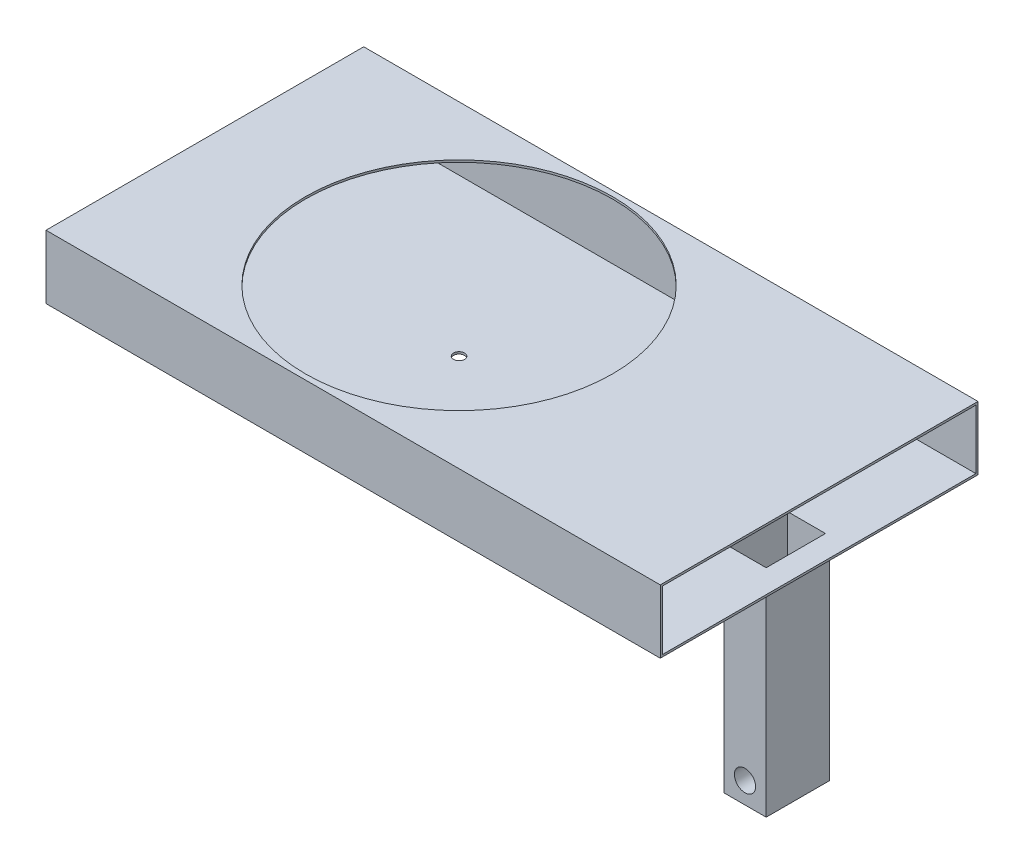
from build123d import *

# Parameters (mm, degrees)
SKETCH1_W           = 736.6
SKETCH1_H           = 381
BOSS_EXTRUDE1_DEPTH = 76.2
SKETCH2_W           = 50.8
SKETCH2_H           = 76.2
BOSS_EXTRUDE2_DEPTH = 254
SKETCH3_R           = 12.7
CUT_EXTRUDE1_DEPTH  = 503.413027299
SHELL1_T            = -2.54
SKETCH4_R           = 184.15
CUT_EXTRUDE2_DEPTH  = 2.54
SKETCH5_R           = 6.621401099
CUT_EXTRUDE3_DEPTH  = 1219.2


with BuildPart() as part:
    # Sketch1 → Boss-Extrude1 (new body)
    with BuildSketch(Plane(origin=(0, 0, 0), x_dir=(1, 0, 0), z_dir=(0, 1, 0))):
        Rectangle(SKETCH1_W, SKETCH1_H)
    extrude(amount=BOSS_EXTRUDE1_DEPTH)

    # Sketch2 → Boss-Extrude2 (add)
    with BuildSketch(Plane(origin=(0, 0, 0), x_dir=(-1, 0, 0), z_dir=(0, -1, 0))):
        with Locations((-317.5, 0)):
            Rectangle(SKETCH2_W, SKETCH2_H)
    extrude(amount=BOSS_EXTRUDE2_DEPTH)

    # Sketch3 → Cut-Extrude1 (cut, through all)
    with BuildSketch(Plane.XY.offset(38.1)):
        with Locations((317.5, -228.6)):
            Circle(SKETCH3_R)
    extrude(amount=-CUT_EXTRUDE1_DEPTH, mode=Mode.SUBTRACT)

    # Shell1
    shell1_openings = [part.faces().sort_by_distance(p)[0] for p in [
        (-368.3, 38.1, 0),
        (368.3, 38.1, 0),
    ]]
    offset(amount=SHELL1_T, openings=shell1_openings, kind=Kind.INTERSECTION)

    # Sketch4 → Cut-Extrude2 (cut)
    with BuildSketch(Plane(origin=(0, 76.2, 0), x_dir=(1, 0, 0), z_dir=(0, 1, 0))):
        with Locations(Location((-63.5, 0, 0), (0, 0, 270))):
            Circle(SKETCH4_R)
    extrude(amount=-CUT_EXTRUDE2_DEPTH, mode=Mode.SUBTRACT)

    # Sketch5 → Cut-Extrude3 (cut)
    with BuildSketch(Plane(origin=(0, 76.2, 0), x_dir=(1, 0, 0), z_dir=(0, 1, 0))):
        with Locations(Location((-63.5, 0, 0), (0, 0, 270))):
            Circle(SKETCH5_R)
    extrude(amount=-CUT_EXTRUDE3_DEPTH, mode=Mode.SUBTRACT)


solid = part.part
